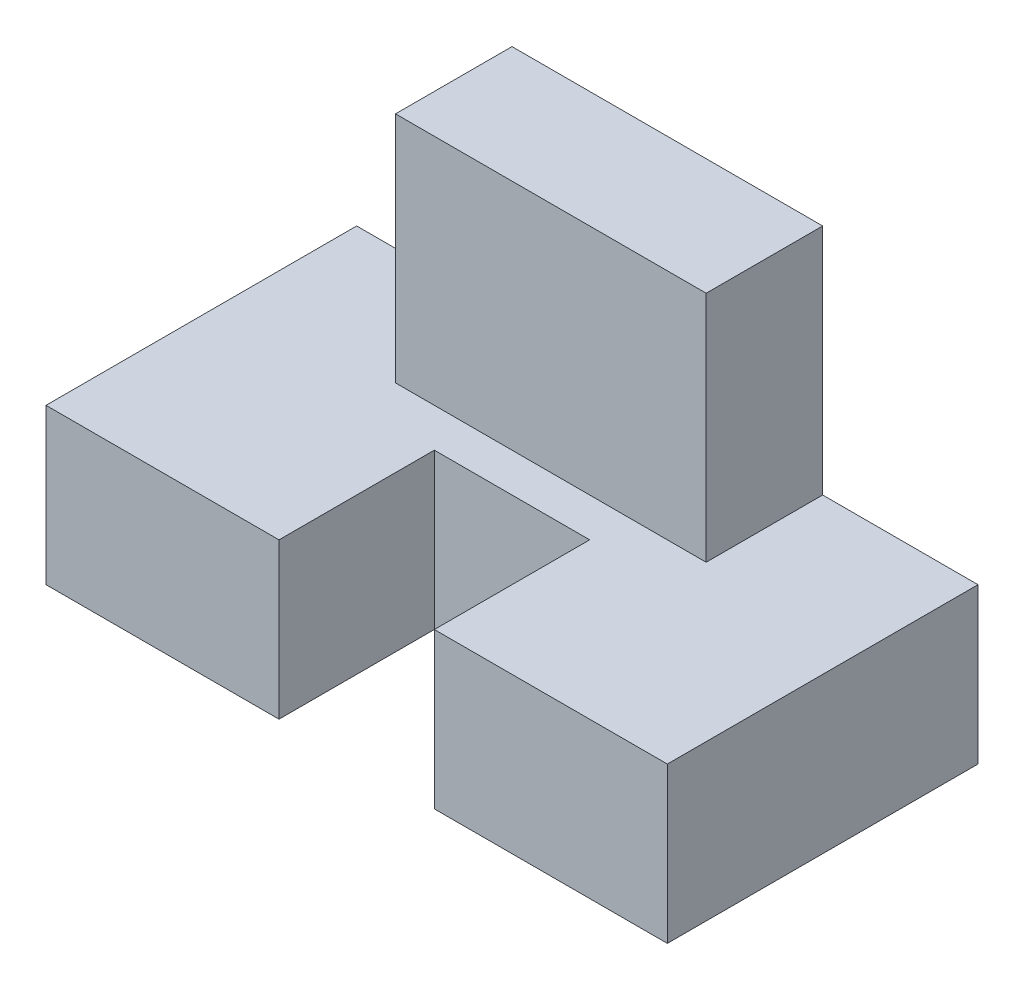
from build123d import *

# Parameters (mm, degrees)
BOSS_EXTRUDE1_DEPTH = 25.4
SKETCH6_W           = 50.8
SKETCH6_H           = 19.05
BOSS_EXTRUDE2_DEPTH = 38.1


with BuildPart() as part:
    # Sketch3 → Boss-Extrude1 (new body)
    with BuildSketch(Plane(origin=(0, 0, 0), x_dir=(1, 0, 0), z_dir=(0, 1, 0))):
        Polygon((38.1, 0), (38.1, 25.4), (63.5, 25.4), (63.5, 0), (101.6, 0), (101.6, 50.8), (0, 50.8), (0, 0), align=None)
    extrude(amount=BOSS_EXTRUDE1_DEPTH)

    # Sketch6 → Boss-Extrude2 (add)
    with BuildSketch(Plane(origin=(0, 25.4, 0), x_dir=(1, 0, 0), z_dir=(0, 1, 0))):
        with Locations((50.8, 41.275)):
            Rectangle(SKETCH6_W, SKETCH6_H)
    extrude(amount=BOSS_EXTRUDE2_DEPTH)


solid = part.part
